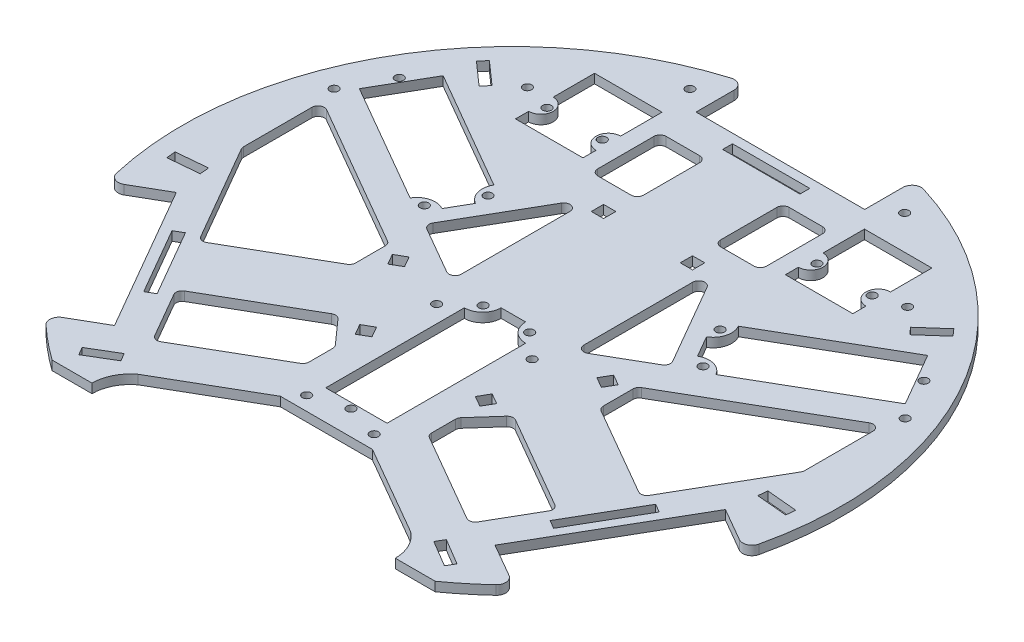
from build123d import *

# Parameters (mm, degrees)
SKETCH1_R              = 1.4
SKETCH1_W              = 4
SKETCH1_H              = 4
BASE_DEPTH             = 3
SKETCH2_R              = 1.4
HOLES_DE_SOPORTS_DEPTH = 3
CUT_DE_SOPORTES_DEPTH  = 3


with BuildPart() as part:
    # Sketch1 → Base (new body)
    with BuildSketch(Plane(origin=(0, 0, 0), x_dir=(1, 0, 0), z_dir=(0, 1, 0))):
        with BuildLine():
            Line((-49.449979984, -87.5), (-62.449979984, -87.5))
            ThreePointArc((-62.449979984, -87.5), (-68.051142746, -83.21833915), (-73.359604514, -78.57874029))
            ThreePointArc((-73.359604514, -78.57874029), (-74.292971461, -76.045325384), (-72.812253229, -73.787707511))
            Line((-72.812253229, -73.787707511), (-71.766157076, -73.183800793))
            Line((-71.766157076, -73.183800793), (-62.029992601, -67.563155772))
            Line((-62.029992601, -67.563155772), (-89.528039953, -19.930631255))
            Line((-89.528039953, -19.930631255), (-99.264204428, -25.551276276))
            Line((-99.264204428, -25.551276276), (-100.31030058, -26.155182994))
            ThreePointArc((-100.31030058, -26.155182994), (-103.005826705, -26.308492659), (-104.732974763, -24.233324105))
            ThreePointArc((-104.732974763, -24.233324105), (-93.09662916, 53.751908236), (-31.375598086, 102.819365125))
            ThreePointArc((-31.375598086, 102.819365125), (-28.714894157, 102.361086233), (-27.5, 99.949987494))
            Line((-27.5, 99.949987494), (-27.5, 98.742088291))
            Line((-27.5, 98.742088291), (-27.5, 87.5))
            Line((-27.5, 87.5), (27.5, 87.5))
            Line((27.5, 87.5), (27.5, 98.742088291))
            Line((27.5, 98.742088291), (27.5, 99.949987494))
            ThreePointArc((27.5, 99.949987494), (28.714894157, 102.361086233), (31.375598086, 102.819365125))
            ThreePointArc((31.375598086, 102.819365125), (93.09662916, 53.751908236), (104.732974763, -24.233324105))
            ThreePointArc((104.732974763, -24.233324105), (103.005826705, -26.308492659), (100.31030058, -26.155182994))
            Line((100.31030058, -26.155182994), (99.264204428, -25.551276276))
            Line((99.264204428, -25.551276276), (89.528039953, -19.930631255))
            Line((89.528039953, -19.930631255), (62.029992601, -67.563155772))
            Line((62.029992601, -67.563155772), (71.766157076, -73.183800793))
            Line((71.766157076, -73.183800793), (72.812253229, -73.787707511))
            ThreePointArc((72.812253229, -73.787707511), (74.292971461, -76.045325384), (73.359604514, -78.57874029))
            ThreePointArc((73.359604514, -78.57874029), (68.051142746, -83.21833915), (62.449979984, -87.5))
            Line((62.449979984, -87.5), (49.449979984, -87.5))
            ThreePointArc((49.449979984, -87.5), (48.12884185, -81.908685559), (44.444863729, -77.5))
            Line((44.444863729, -77.5), (15, -60.5))
            Line((15, -60.5), (-15, -60.5))
            Line((-15, -60.5), (-44.444863729, -77.5))
            ThreePointArc((-44.444863729, -77.5), (-48.12884185, -81.908685559), (-49.449979984, -87.5))
        make_face()
        with Locations(Location((-62, 67, 0), (0, 0, 270))):
            Circle(SKETCH1_R, mode=Mode.SUBTRACT)
        with Locations(Location((-15.588826206, -8.999360951, 0), (0, 0, 270))):
            Circle(SKETCH1_R, mode=Mode.SUBTRACT)
        with Locations(Location((15.588826206, -8.999360951, 0), (0, 0, 90))):
            Circle(SKETCH1_R, mode=Mode.SUBTRACT)
        with Locations(Location((62, 67, 0), (0, 0, 90))):
            Circle(SKETCH1_R, mode=Mode.SUBTRACT)
        with Locations(Location((85.530380455, 48.775035462, 0), (0, 0, 90))):
            Circle(SKETCH1_R, mode=Mode.SUBTRACT)
        with Locations(Location((45.441079016, 16.853742393, 0), (0, 0, 270))):
            Circle(SKETCH1_R, mode=Mode.SUBTRACT)
        with Locations(Location((37.841079016, 30.01732853, 0), (0, 0, 270))):
            Circle(SKETCH1_R, mode=Mode.SUBTRACT)
        with Locations(Location((-37.841079016, 30.01732853, 0), (0, 0, 90))):
            Circle(SKETCH1_R, mode=Mode.SUBTRACT)
        with Locations(Location((-45.441079016, 16.853742393, 0), (0, 0, 90))):
            Circle(SKETCH1_R, mode=Mode.SUBTRACT)
        with Locations(Location((-85.530380455, 48.775035462, 0), (0, 0, 270))):
            Circle(SKETCH1_R, mode=Mode.SUBTRACT)
        with Locations(Location((-53, 64.423048454, 0), (0, 0, 270))):
            Circle(SKETCH1_R, mode=Mode.SUBTRACT)
        with Locations(Location((-35, 64.423048454, 0), (0, 0, 270))):
            Circle(SKETCH1_R, mode=Mode.SUBTRACT)
        with Locations(Location((35, 64.423048454, 0), (0, 0, 90))):
            Circle(SKETCH1_R, mode=Mode.SUBTRACT)
        with Locations(Location((53, 64.423048454, 0), (0, 0, 90))):
            Circle(SKETCH1_R, mode=Mode.SUBTRACT)
        with Locations(Location((7.6, -1.824563146, 0), (0, 0, 270))):
            Circle(SKETCH1_R, mode=Mode.SUBTRACT)
        with Locations(Location((-7.6, -1.824563146, 0), (0, 0, 270))):
            Circle(SKETCH1_R, mode=Mode.SUBTRACT)
        with Locations(Location((0, -52.502563146, 0), (0, 0, 270))):
            Circle(SKETCH1_R, mode=Mode.SUBTRACT)
        Polygon((12.6, 84.5), (12.6, 81.3), (-12.6, 81.3), (-12.6, 84.5), (0, 84.5), align=None, mode=Mode.SUBTRACT)
        with BuildLine():
            Line((-10, -44.724563146), (-10, -5.544563146))
            ThreePointArc((-10, -5.544563146), (-5.757359313, -3.787203833), (-4, 0.455436854))
            Line((-4, 0.455436854), (4, 0.455436854))
            ThreePointArc((4, 0.455436854), (5.757359313, -3.787203833), (10, -5.544563146))
            Line((10, -5.544563146), (10, -44.724563146))
            Line((10, -44.724563146), (10, -50.724563146))
            Line((10, -50.724563146), (4, -50.724563146))
            Line((4, -50.724563146), (-4, -50.724563146))
            Line((-4, -50.724563146), (-10, -50.724563146))
            Line((-10, -50.724563146), (-10, -44.724563146))
        make_face(mode=Mode.SUBTRACT)
        with BuildLine():
            Line((-20.506461194, -37.091080552), (-27.485195822, -29.255208748))
            ThreePointArc((-27.485195822, -29.255208748), (-28.660460013, -28.610861921), (-29.978663622, -28.853283041))
            Line((-29.978663622, -28.853283041), (-60.3868205, -46.407778549))
            ThreePointArc((-60.3868205, -46.407778549), (-61.318721936, -47.622153065), (-61.118983306, -49.139799345))
            Line((-61.118983306, -49.139799345), (-52.619586852, -63.86257965))
            ThreePointArc((-52.619586852, -63.86257965), (-51.405212337, -64.794481086), (-49.887566057, -64.594742456))
            Line((-49.887566057, -64.594742456), (-21.000071005, -47.918118345))
            ThreePointArc((-21.000071005, -47.918118345), (-20.26796969, -47.186062047), (-20, -46.186026545))
            Line((-20, -46.186026545), (-20, -38.421246645))
            ThreePointArc((-20, -38.421246645), (-20.130898931, -37.709585775), (-20.506461194, -37.091080552))
        make_face(mode=Mode.SUBTRACT)
        Polygon((-76.659087911, -29.821539877), (-79.430434792, -31.421426268), (-66.83132946, -53.245782956), (-64.059982579, -51.645896564), align=None, mode=Mode.SUBTRACT)
        Polygon((-22.31838288, -27.317719613), (-20.31852489, -30.781903215), (-16.854341289, -28.782045226), (-18.854199278, -25.317861624), align=None, mode=Mode.SUBTRACT)
        with BuildLine():
            Line((-23, 1.732050808), (-38.341978046, 10.589745962))
            ThreePointArc((-38.341978046, 10.589745962), (-39.273829698, 11.80415868), (-39.074028853, 13.32179677))
            Line((-39.074028853, 13.32179677), (-23.732050808, 39.894882233))
            ThreePointArc((-23.732050808, 39.894882233), (-21.48236191, 40.826733886), (-20, 38.894882233))
            Line((-20, 38.894882233), (-20, 3.464101615))
            ThreePointArc((-20, 3.464101615), (-21, 1.732050808), (-23, 1.732050808))
        make_face(mode=Mode.SUBTRACT)
        with Locations((-14.5, 44.358983849)):
            Rectangle(SKETCH1_W, SKETCH1_H, mode=Mode.SUBTRACT)
        Polygon((-31.353311711, -3.666714117), (-33.3531697, -0.202530515), (-36.817353301, -2.202388505), (-34.817495312, -5.666572106), align=None, mode=Mode.SUBTRACT)
        with BuildLine():
            Line((-40.393980237, -10.617780206), (-40.393980237, -0.927235943))
            ThreePointArc((-40.393980237, -0.927235943), (-40.661929429, 0.072764057), (-41.393980237, 0.804814865))
            Line((-41.393980237, 0.804814865), (-88.47, 27.984167548))
            ThreePointArc((-88.47, 27.984167548), (-90.47, 27.984167548), (-91.47, 26.25211674))
            Line((-91.47, 26.25211674), (-91.47, 3.97053533))
            ThreePointArc((-91.47, 3.97053533), (-91.401862262, 3.452936838), (-91.202091801, 2.970606336))
            Line((-91.202091801, 2.970606336), (-73.118131241, -28.354697737))
            ThreePointArc((-73.118131241, -28.354697737), (-71.903756726, -29.286599173), (-70.386110446, -29.086860543))
            Line((-70.386110446, -29.086860543), (-41.394051242, -12.349872007))
            ThreePointArc((-41.394051242, -12.349872007), (-40.661949927, -11.617815708), (-40.393980237, -10.617780206))
        make_face(mode=Mode.SUBTRACT)
        with BuildLine():
            Line((-49.862693519, 16.635281424), (-88.990587287, 39.225781424))
            Line((-88.990587287, 39.225781424), (-78.990587287, 56.546289499))
            Line((-78.990587287, 56.546289499), (-39.862693519, 33.955789499))
            ThreePointArc((-39.862693519, 33.955789499), (-40.462096054, 29.402875229), (-37.666541096, 25.759637077))
            Line((-37.666541096, 25.759637077), (-41.666541096, 18.831433846))
            ThreePointArc((-41.666541096, 18.831433846), (-46.219455366, 19.430836381), (-49.862693519, 16.635281424))
        make_face(mode=Mode.SUBTRACT)
        with BuildLine():
            Line((-33, 56.143048454), (-55, 56.143048454))
            Line((-55, 56.143048454), (-55, 60.423048454))
            ThreePointArc((-55, 60.423048454), (-51, 64.423048454), (-55, 68.423048454))
            Line((-55, 68.423048454), (-55, 81.923048454))
            Line((-55, 81.923048454), (-33, 81.923048454))
            Line((-33, 81.923048454), (-33, 68.408015566))
            ThreePointArc((-33, 68.408015566), (-37, 64.408015566), (-33, 60.408015566))
            Line((-33, 60.408015566), (-33, 56.143048454))
        make_face(mode=Mode.SUBTRACT)
        Polygon((76.659087911, -29.821539877), (79.430434792, -31.421426268), (66.83132946, -53.245782956), (64.059982579, -51.645896564), align=None, mode=Mode.SUBTRACT)
        with BuildLine():
            Line((61.118983306, -49.139799345), (52.619586852, -63.86257965))
            ThreePointArc((52.619586852, -63.86257965), (51.405212337, -64.794481086), (49.887566057, -64.594742456))
            Line((49.887566057, -64.594742456), (21.000071005, -47.918118345))
            ThreePointArc((21.000071005, -47.918118345), (20.26796969, -47.186062047), (20, -46.186026545))
            Line((20, -46.186026545), (20, -38.421246645))
            ThreePointArc((20, -38.421246645), (20.130898931, -37.709585775), (20.506461194, -37.091080552))
            Line((20.506461194, -37.091080552), (27.485195822, -29.255208748))
            ThreePointArc((27.485195822, -29.255208748), (28.660460013, -28.610861921), (29.978663622, -28.853283041))
            Line((29.978663622, -28.853283041), (60.3868205, -46.407778549))
            ThreePointArc((60.3868205, -46.407778549), (61.318721936, -47.622153065), (61.118983306, -49.139799345))
        make_face(mode=Mode.SUBTRACT)
        Polygon((22.31838288, -27.317719613), (20.31852489, -30.781903215), (16.854341289, -28.782045226), (18.854199278, -25.317861624), align=None, mode=Mode.SUBTRACT)
        Polygon((33.3531697, -0.202530515), (36.817353301, -2.202388505), (34.817495312, -5.666572106), (31.353311711, -3.666714117), align=None, mode=Mode.SUBTRACT)
        with BuildLine():
            Line((91.202091801, 2.970606336), (73.118131241, -28.354697737))
            ThreePointArc((73.118131241, -28.354697737), (71.903756726, -29.286599173), (70.386110446, -29.086860543))
            Line((70.386110446, -29.086860543), (41.394051242, -12.349872007))
            ThreePointArc((41.394051242, -12.349872007), (40.661949927, -11.617815708), (40.393980237, -10.617780206))
            Line((40.393980237, -10.617780206), (40.393980237, -0.927235943))
            ThreePointArc((40.393980237, -0.927235943), (40.661929429, 0.072764057), (41.393980237, 0.804814865))
            Line((41.393980237, 0.804814865), (88.47, 27.984167548))
            ThreePointArc((88.47, 27.984167548), (90.47, 27.984167548), (91.47, 26.25211674))
            Line((91.47, 26.25211674), (91.47, 3.97053533))
            ThreePointArc((91.47, 3.97053533), (91.401862262, 3.452936838), (91.202091801, 2.970606336))
        make_face(mode=Mode.SUBTRACT)
        with BuildLine():
            Line((20, 38.894882233), (20, 3.464101615))
            ThreePointArc((20, 3.464101615), (21, 1.732050808), (23, 1.732050808))
            Line((23, 1.732050808), (38.341978046, 10.589745962))
            ThreePointArc((38.341978046, 10.589745962), (39.273829698, 11.80415868), (39.074028853, 13.32179677))
            Line((39.074028853, 13.32179677), (23.732050808, 39.894882233))
            ThreePointArc((23.732050808, 39.894882233), (21.48236191, 40.826733886), (20, 38.894882233))
        make_face(mode=Mode.SUBTRACT)
        with Locations((14.5, 44.358983849)):
            Rectangle(SKETCH1_W, SKETCH1_H, mode=Mode.SUBTRACT)
        with BuildLine():
            Line((88.990587287, 39.225781424), (78.990587287, 56.546289499))
            Line((78.990587287, 56.546289499), (39.862693519, 33.955789499))
            ThreePointArc((39.862693519, 33.955789499), (40.462096054, 29.402875229), (37.666541096, 25.759637077))
            Line((37.666541096, 25.759637077), (41.666541096, 18.831433846))
            ThreePointArc((41.666541096, 18.831433846), (46.219455366, 19.430836381), (49.862693519, 16.635281424))
            Line((49.862693519, 16.635281424), (88.990587287, 39.225781424))
        make_face(mode=Mode.SUBTRACT)
        with BuildLine():
            Line((-25.5, 75.776417602), (-14.6, 75.776417602))
            ThreePointArc((-14.6, 75.776417602), (-13.185786438, 75.190631165), (-12.6, 73.776417602))
            Line((-12.6, 73.776417602), (-12.6, 55.454674658))
            ThreePointArc((-12.6, 55.454674658), (-13.185786438, 54.040461096), (-14.6, 53.454674658))
            Line((-14.6, 53.454674658), (-25.5, 53.454674658))
            ThreePointArc((-25.5, 53.454674658), (-26.914213562, 54.040461096), (-27.5, 55.454674658))
            Line((-27.5, 55.454674658), (-27.5, 73.776417602))
            ThreePointArc((-27.5, 73.776417602), (-26.914213562, 75.190631165), (-25.5, 75.776417602))
        make_face(mode=Mode.SUBTRACT)
        with BuildLine():
            Line((27.5, 73.776417602), (27.5, 55.454674658))
            ThreePointArc((27.5, 55.454674658), (26.914213562, 54.040461096), (25.5, 53.454674658))
            Line((25.5, 53.454674658), (14.6, 53.454674658))
            ThreePointArc((14.6, 53.454674658), (13.185786438, 54.040461096), (12.6, 55.454674658))
            Line((12.6, 55.454674658), (12.6, 73.776417602))
            ThreePointArc((12.6, 73.776417602), (13.185786438, 75.190631165), (14.6, 75.776417602))
            Line((14.6, 75.776417602), (25.5, 75.776417602))
            ThreePointArc((25.5, 75.776417602), (26.914213562, 75.190631165), (27.5, 73.776417602))
        make_face(mode=Mode.SUBTRACT)
        with BuildLine():
            Line((33, 81.923048454), (33, 68.408015566))
            ThreePointArc((33, 68.408015566), (37, 64.408015566), (33, 60.408015566))
            Line((33, 60.408015566), (33, 56.143048454))
            Line((33, 56.143048454), (55, 56.143048454))
            Line((55, 56.143048454), (55, 60.423048454))
            ThreePointArc((55, 60.423048454), (51, 64.423048454), (55, 68.423048454))
            Line((55, 68.423048454), (55, 81.923048454))
            Line((55, 81.923048454), (33, 81.923048454))
        make_face(mode=Mode.SUBTRACT)
    extrude(amount=BASE_DEPTH)

    # Sketch2 → Holes de soports (cut)
    with BuildSketch(Plane(origin=(0, 0, 0), x_dir=(1, 0, 0), z_dir=(0, 1, 0))):
        with Locations(Location((-35, 93.034187265, 0), (0, 0, 270))):
            Circle(SKETCH2_R)
        with Locations(Location((-93.103383397, 35.1, 0), (0, 0, 270))):
            Circle(SKETCH2_R)
        with Locations(Location((-11, -55.928525816, 0), (0, 0, 270))):
            Circle(SKETCH2_R)
        with Locations(Location((11, -55.928525816, 0), (0, 0, 90))):
            Circle(SKETCH2_R)
        with Locations(Location((93.103383397, 35.1, 0), (0, 0, 90))):
            Circle(SKETCH2_R)
        with Locations(Location((35, 93.034187265, 0), (0, 0, 90))):
            Circle(SKETCH2_R)
        with Locations(Location((-58, -78.993670633, 0), (0, 0, 270))):
            Circle(SKETCH2_R)
        with Locations(Location((58, -78.993670633, 0), (0, 0, 90))):
            Circle(SKETCH2_R)
    extrude(amount=HOLES_DE_SOPORTS_DEPTH, mode=Mode.SUBTRACT)

    # Sketch5 → Cut de soportes (cut)
    with BuildSketch(Plane(origin=(0, 3, 0), x_dir=(1, 0, 0), z_dir=(0, 1, 0))):
        Polygon((-59.590222061, -81.624575095), (-61.12759459, -79.048437344), (-52.540468755, -73.92386225), (-51.003096227, -76.5), align=None)
        Polygon((-75.714157066, 68.354553306), (-68.226913294, 61.725738879), (-70.215557622, 59.479565747), (-77.702801394, 66.108380174), align=None)
        Polygon((-101.17241918, -8.667383435), (-91.17241918, -7.75555233), (-90.9, -10.743158025), (-100.9, -11.65498913), align=None)
        Polygon((100.9, -11.65498913), (90.9, -10.743158025), (91.17241918, -7.75555233), (101.17241918, -8.667383435), align=None)
        Polygon((77.702801394, 66.108380174), (70.215557622, 59.479565747), (68.226913294, 61.725738879), (75.714157066, 68.354553306), align=None)
        Polygon((61.12759459, -79.048437344), (52.540468755, -73.92386225), (51.003096227, -76.5), (59.590222061, -81.624575095), align=None)
    extrude(amount=-CUT_DE_SOPORTES_DEPTH, mode=Mode.SUBTRACT)


solid = part.part
